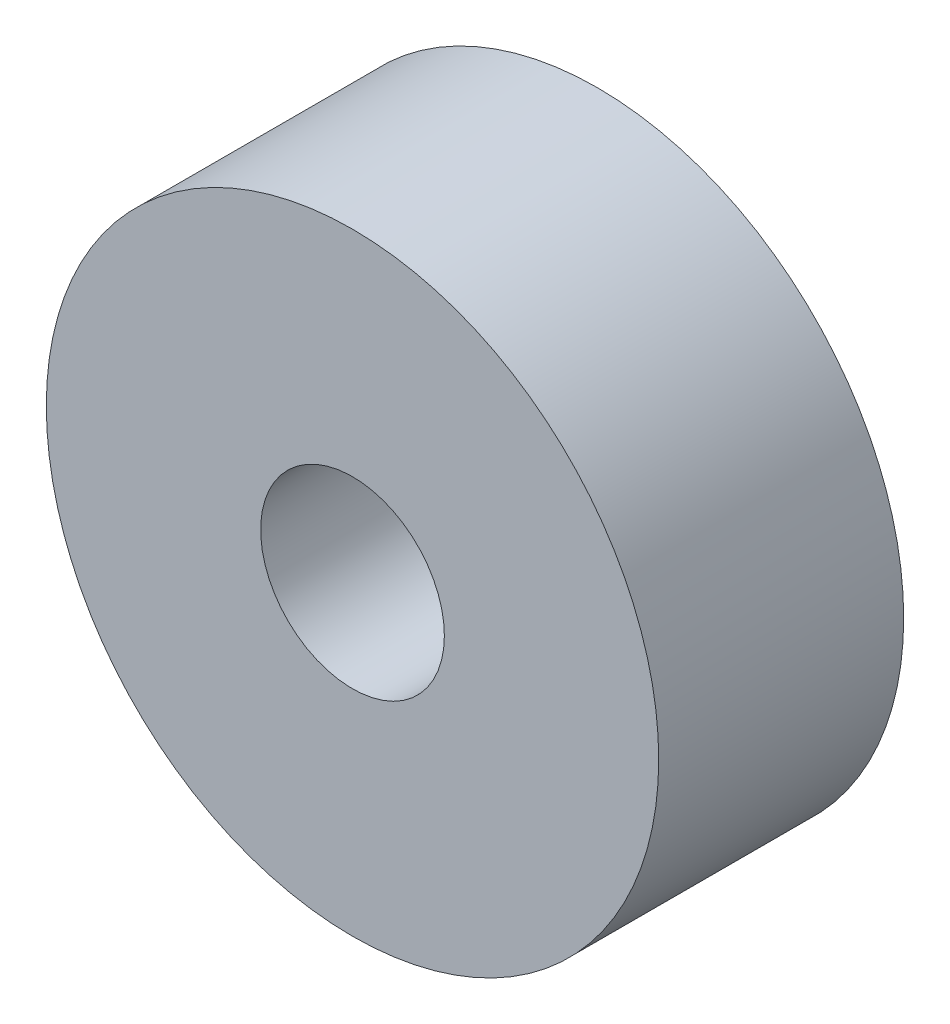
from build123d import *

# Parameters (mm, degrees)
SKETCH1_R           = 5
SKETCH1_R_2         = 1.5
BOSS_EXTRUDE1_DEPTH = 2


with BuildPart() as part:
    # Sketch1 → Boss-Extrude1 (new, symmetric)
    with BuildSketch(Plane.XY):
        Circle(SKETCH1_R)
        Circle(SKETCH1_R_2, mode=Mode.SUBTRACT)
    extrude(amount=BOSS_EXTRUDE1_DEPTH, both=True)


solid = part.part
